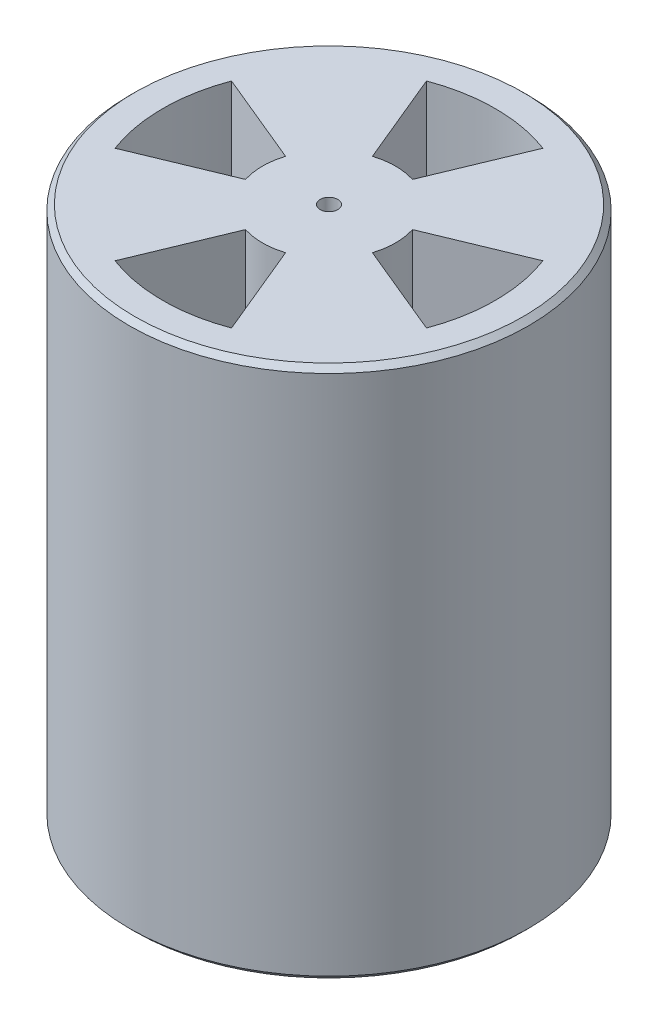
from build123d import *

# Parameters (mm, degrees)
SKETCH1_R               = 76.1365
BOSS_EXTRUDE1_DEPTH     = 203.2
CHAMFER1_SIZE           = 2.032
CUT_EXTRUDE2_DEPTH      = 230.964721782
CUT_EXTRUDE2_DEPTH_BACK = 230.964721782
F_1_4_CLEARANCE_HOLE1_D = 6.7564
SKETCH6_R               = 15.875
CUT_EXTRUDE3_DEPTH      = 15.875
CHAMFER2_SIZE           = 2.54


with BuildPart() as part:
    # Sketch1 → Boss-Extrude1 (new body)
    with BuildSketch(Plane(origin=(0, 0, 0), x_dir=(1, 0, 0), z_dir=(0, 1, 0))):
        with Locations(Location((0, 0, 0), (0, 0, 270))):
            Circle(SKETCH1_R)
    extrude(amount=BOSS_EXTRUDE1_DEPTH)

    # Chamfer1
    chamfer1_edges = [part.edges().sort_by_distance(p)[0] for p in [
        (0, 0, -76.1365),
        (0, 203.2, -76.1365),
    ]]
    chamfer(chamfer1_edges, length=CHAMFER1_SIZE)

    # Sketch3 → Cut-Extrude2 (cut, two sides: drawn at the far end of the back side and taken through both)
    with BuildSketch(Plane(origin=(0, 203.2, 0), x_dir=(1, 0, 0), z_dir=(0, 1, 0)).offset(-CUT_EXTRUDE2_DEPTH_BACK)):
        with BuildLine():
            Line((-7.6470512, 24.221531908), (-22.225, 59.415813613))
            ThreePointArc((-22.225, 59.415813613), (0, 63.4365), (22.225, 59.415813613))
            Line((22.225, 59.415813613), (7.6470512, 24.221531908))
            ThreePointArc((7.6470512, 24.221531908), (0, 25.4), (-7.6470512, 24.221531908))
        make_face()
        with BuildLine():
            Line((24.221531908, 7.6470512), (59.415813613, 22.225))
            ThreePointArc((59.415813613, 22.225), (63.4365, 0), (59.415813613, -22.225))
            Line((59.415813613, -22.225), (24.221531908, -7.6470512))
            ThreePointArc((24.221531908, -7.6470512), (25.4, 0), (24.221531908, 7.6470512))
        make_face()
        with BuildLine():
            Line((7.6470512, -24.221531908), (22.225, -59.415813613))
            ThreePointArc((22.225, -59.415813613), (0, -63.4365), (-22.225, -59.415813613))
            Line((-22.225, -59.415813613), (-7.6470512, -24.221531908))
            ThreePointArc((-7.6470512, -24.221531908), (0, -25.4), (7.6470512, -24.221531908))
        make_face()
        with BuildLine():
            Line((-24.221531908, -7.6470512), (-59.415813613, -22.225))
            ThreePointArc((-59.415813613, -22.225), (-63.4365, 0), (-59.415813613, 22.225))
            Line((-59.415813613, 22.225), (-24.221531908, 7.6470512))
            ThreePointArc((-24.221531908, 7.6470512), (-25.4, 0), (-24.221531908, -7.6470512))
        make_face()
    extrude(amount=CUT_EXTRUDE2_DEPTH + CUT_EXTRUDE2_DEPTH_BACK, mode=Mode.SUBTRACT)

    # 1/4 Clearance Hole1 (through all)
    with Locations(Plane(origin=(0, 203.2, 0), x_dir=(1, 0, 0), z_dir=(0, 1, 0))):
        with Locations((0, 0)):
            Hole(F_1_4_CLEARANCE_HOLE1_D / 2)

    # Sketch6 → Cut-Extrude3 (cut)
    with BuildSketch(Plane.XZ):
        with Locations(Location((0, 0, 0), (0, 0, 270))):
            Circle(SKETCH6_R)
    extrude(amount=-CUT_EXTRUDE3_DEPTH, mode=Mode.SUBTRACT)

    # Chamfer2
    chamfer2_edges = [part.edges().sort_by_distance(p)[0] for p in [
        (0, 0, 15.875),
    ]]
    chamfer(chamfer2_edges, length=CHAMFER2_SIZE)


solid = part.part
